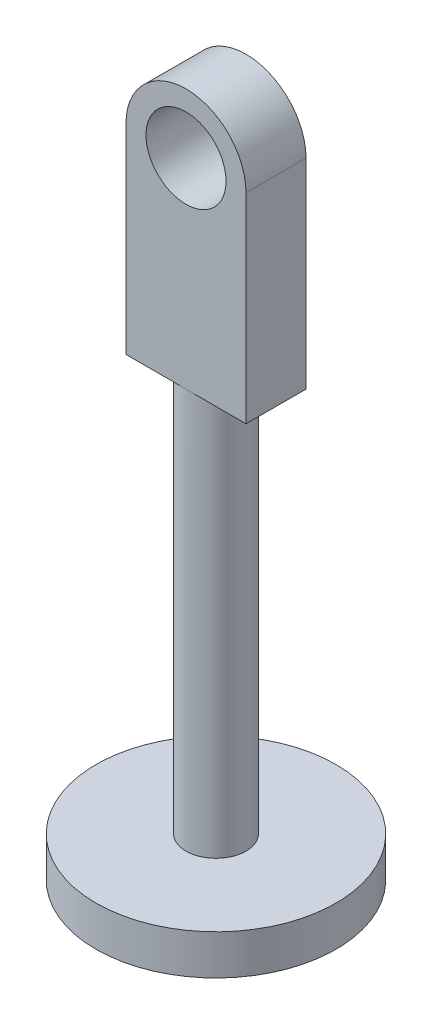
from build123d import *

# Parameters (mm, degrees)
SKETCH_1_R      = 2
EXTRUDE_1_DEPTH = 1.5
SKETCH_2_R      = 1.5
EXTRUDE_2_DEPTH = 20
SKETCH_3_R      = 6
EXTRUDE_3_DEPTH = 2


with BuildPart() as part:
    # 草图1 → 凸台-拉伸1 (new, symmetric)
    with BuildSketch(Plane.XY):
        with BuildLine():
            Line((0, 0), (6, 0))
            Line((6, 0), (6, 10))
            ThreePointArc((6, 10), (3, 13), (0, 10))
            Line((0, 10), (0, 0))
        make_face()
        with Locations((3, 10)):
            Circle(SKETCH_1_R, mode=Mode.SUBTRACT)
    extrude(amount=EXTRUDE_1_DEPTH, both=True)

    # 草图2 → 凸台-拉伸2 (add)
    with BuildSketch(Plane.XZ):
        with Locations(Location((3, 0, 0), (0, 0, 270))):
            Circle(SKETCH_2_R)
    extrude(amount=EXTRUDE_2_DEPTH)

    # 草图3 → 凸台-拉伸3 (add)
    with BuildSketch(Plane.XZ.offset(20)):
        with Locations(Location((3, 0, 0), (0, 0, 270))):
            Circle(SKETCH_3_R)
    extrude(amount=EXTRUDE_3_DEPTH)


solid = part.part
